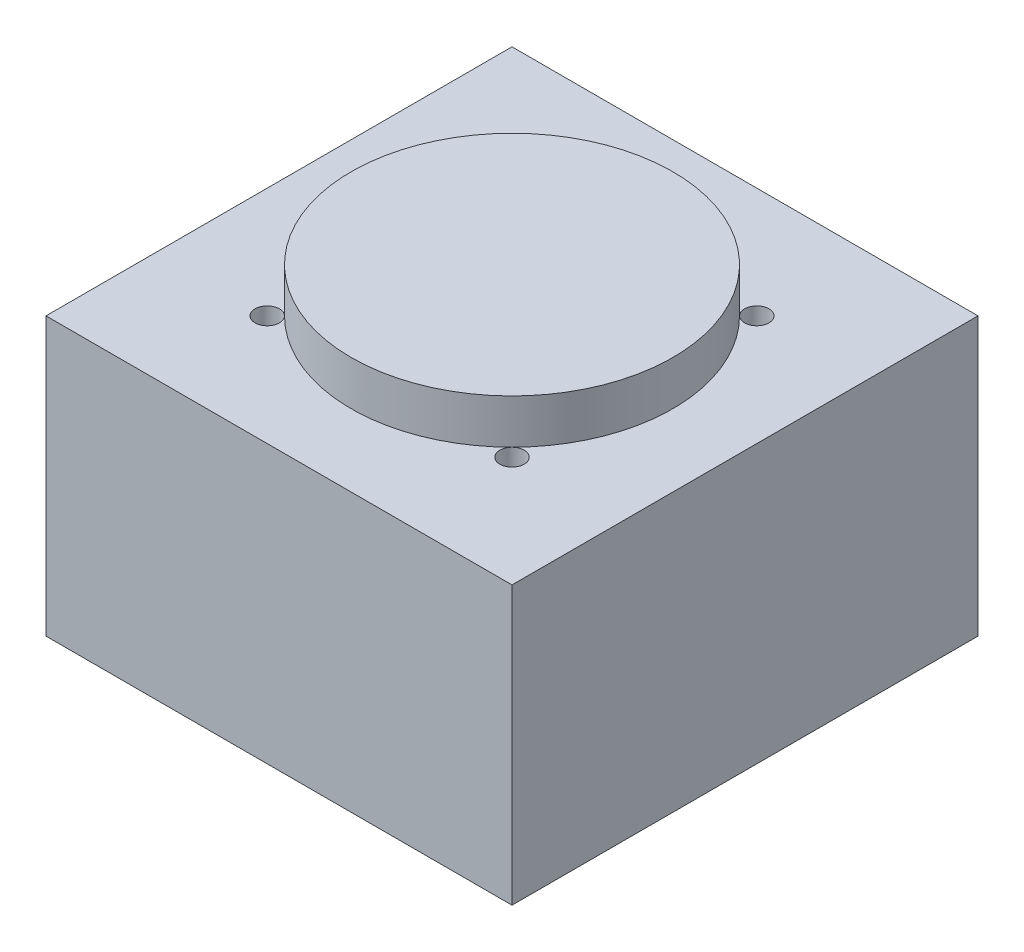
from build123d import *

# Parameters (mm, degrees)
F_01_HOUSING_PROFILE_W        = 210
F_01_HOUSING_PROFILE_H        = 210
F_01_HOUSING_PROFILE_R        = 5.5
F_01_HOUSING_BLOCK_DEPTH      = 125
F_02_FACE_BOSS_PROFILE_R      = 72.5
F_02_FACE_LOCATING_BOSS_DEPTH = 145


with BuildPart() as part:
    # 01_Housing_Profile → 01_Housing_Block (new body)
    with BuildSketch(Plane(origin=(0, 0, 0), x_dir=(1, 0, 0), z_dir=(0, 1, 0))):
        Rectangle(F_01_HOUSING_PROFILE_W, F_01_HOUSING_PROFILE_H)
        with Locations(Location((55.154328933, 55.154328933, 0), (0, 0, 270))):
            Circle(F_01_HOUSING_PROFILE_R, mode=Mode.SUBTRACT)
        with Locations(Location((-55.154328933, 55.154328933, 0), (0, 0, 270))):
            Circle(F_01_HOUSING_PROFILE_R, mode=Mode.SUBTRACT)
        with Locations(Location((-55.154328933, -55.154328933, 0), (0, 0, 270))):
            Circle(F_01_HOUSING_PROFILE_R, mode=Mode.SUBTRACT)
        with Locations(Location((55.154328933, -55.154328933, 0), (0, 0, 270))):
            Circle(F_01_HOUSING_PROFILE_R, mode=Mode.SUBTRACT)
    extrude(amount=F_01_HOUSING_BLOCK_DEPTH)

    # 02_Face_Boss_Profile → 02_Face_Locating_Boss (add)
    with BuildSketch(Plane(origin=(0, 0, 0), x_dir=(1, 0, 0), z_dir=(0, 1, 0))):
        with Locations(Location((0, 0, 0), (0, 0, 134.999974728))):
            Circle(F_02_FACE_BOSS_PROFILE_R)
    extrude(amount=F_02_FACE_LOCATING_BOSS_DEPTH)


solid = part.part
